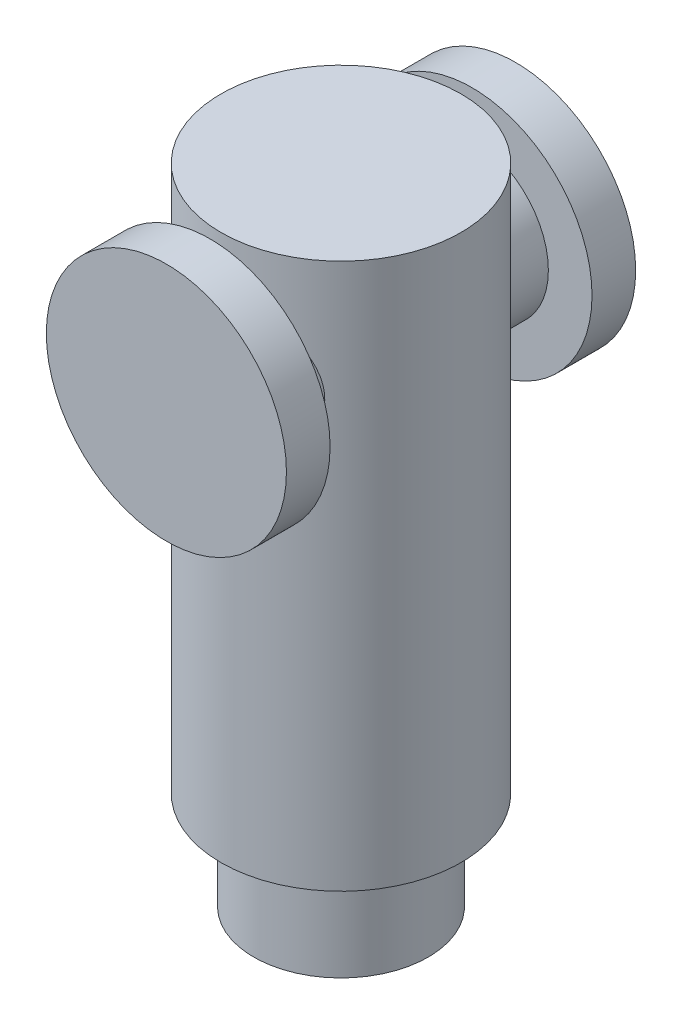
from build123d import *

# Parameters (mm, degrees)
SKETCH1_R                = 34.925
BOSS_EXTRUDE1_DEPTH      = 12.7
SKETCH2_R                = 22.225
BOSS_EXTRUDE2_DEPTH      = 12.7
BOSS_EXTRUDE4_DEPTH      = 34.925
BOSS_EXTRUDE4_DEPTH_BACK = 123.825
SKETCH3_R                = 34.925
CIRPATTERN1_COUNT        = 2
CIRPATTERN2_COUNT        = 2
SKETCH5_R                = 25.4
BOSS_EXTRUDE5_DEPTH      = 28.575


with BuildPart() as part:
    # Sketch1 → Boss-Extrude1 (new body)
    with BuildSketch(Plane.XY):
        Circle(SKETCH1_R)
    boss_extrude1 = extrude(amount=BOSS_EXTRUDE1_DEPTH)

    # Sketch2 → Boss-Extrude2 (add)
    with BuildSketch(Plane.XY.offset(12.7)):
        Circle(SKETCH2_R)
    boss_extrude2 = extrude(amount=BOSS_EXTRUDE2_DEPTH)

    # Sketch3 → Boss-Extrude4 (add, two sides: drawn at the far end of the back side and taken through both)
    with BuildSketch(Plane(origin=(0, 0, 0), x_dir=(1, 0, 0), z_dir=(0, 1, 0)).offset(-BOSS_EXTRUDE4_DEPTH_BACK)):
        with Locations(Location((0, -50.8, 0), (0, 0, 270))):
            Circle(SKETCH3_R)
    extrude(amount=BOSS_EXTRUDE4_DEPTH + BOSS_EXTRUDE4_DEPTH_BACK)

    # CirPattern1: Boss-Extrude2 ×2 about axis
    cirpattern1_axis = Axis((0, 34.925, 50.8), (0, 1, 0))
    for i in range(1, CIRPATTERN1_COUNT):
        add(boss_extrude2.rotate(cirpattern1_axis, i * 360 / CIRPATTERN1_COUNT))

    # CirPattern2: Boss-Extrude1 ×2 about axis
    cirpattern2_axis = Axis((0, 34.925, 50.8), (0, 1, 0))
    for i in range(1, CIRPATTERN2_COUNT):
        add(boss_extrude1.rotate(cirpattern2_axis, i * 360 / CIRPATTERN2_COUNT))

    # Sketch5 → Boss-Extrude5 (add)
    with BuildSketch(Plane.XZ.offset(123.825)):
        with Locations(Location((0, 50.8, 0), (0, 0, 270))):
            Circle(SKETCH5_R)
    extrude(amount=BOSS_EXTRUDE5_DEPTH)


solid = part.part
